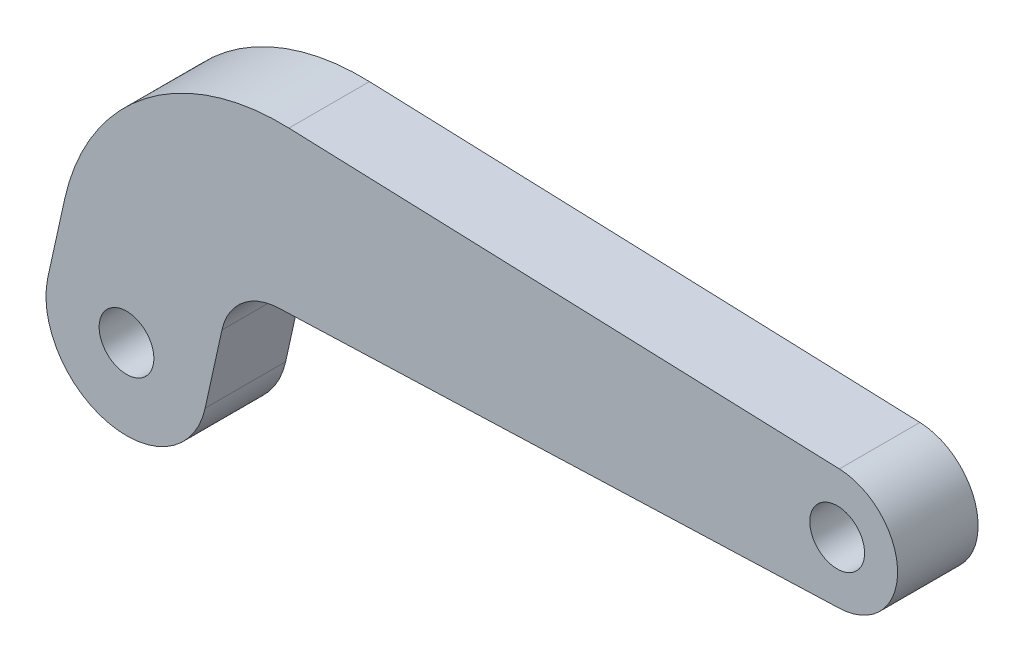
from build123d import *

# Parameters (mm, degrees)
SKETCH1_R           = 2.159
BOSS_EXTRUDE1_DEPTH = 3.175


with BuildPart() as part:
    # Sketch1 → Boss-Extrude1 (new, symmetric)
    with BuildSketch(Plane.XY):
        with BuildLine():
            Line((56.212406906, 19.490008209), (12.807859934, 21.061903429))
            ThreePointArc((12.807859934, 21.061903429), (1.486348152, 17.419283948), (-4.876850173, 7.371646773))
            Line((-4.876850173, 7.371646773), (-6.200989145, 1.36756485))
            ThreePointArc((-6.200989145, 1.36756485), (-1.36756485, -6.200989145), (6.200989145, -1.36756485))
            Line((6.200989145, -1.36756485), (7.525128118, 4.636517072))
            ThreePointArc((7.525128118, 4.636517072), (9.126161655, 7.268805354), (12.003509079, 8.370223433))
            Line((12.003509079, 8.370223433), (56.212406906, 9.971248211))
            ThreePointArc((56.212406906, 9.971248211), (60.802546008, 14.73062821), (56.212406906, 19.490008209))
        make_face()
        Circle(SKETCH1_R, mode=Mode.SUBTRACT)
        with Locations((56.040046008, 14.73062821)):
            Circle(SKETCH1_R, mode=Mode.SUBTRACT)
    extrude(amount=BOSS_EXTRUDE1_DEPTH, both=True)


solid = part.part
